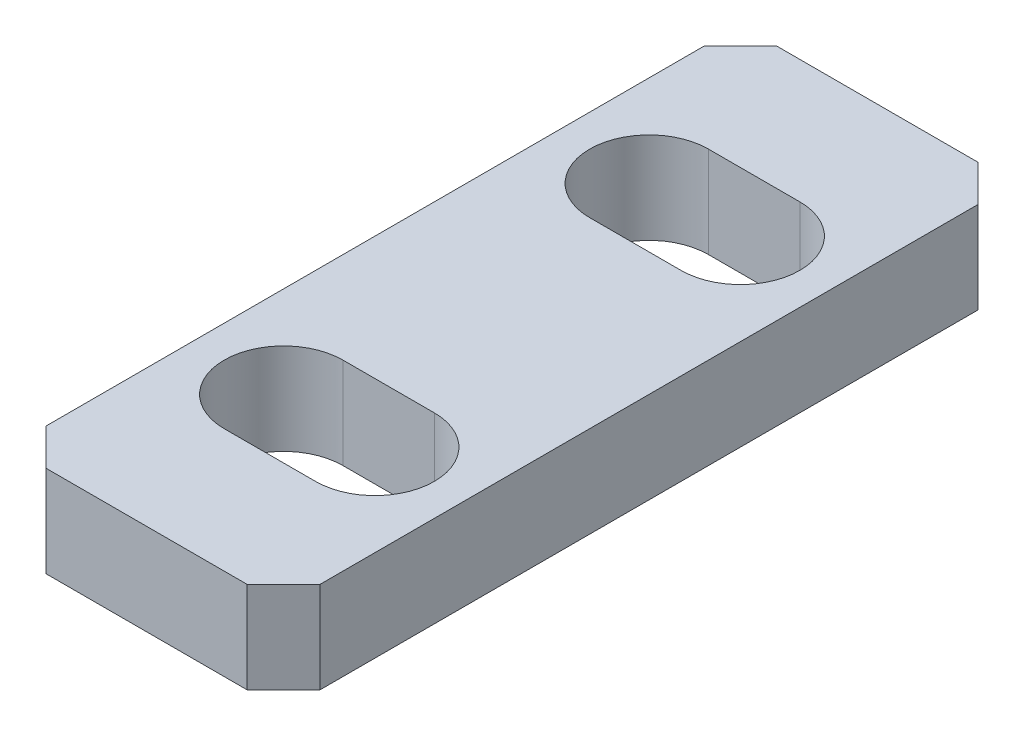
from build123d import *

# Parameters (mm, degrees)
BOSS_EXTRUDE1_DEPTH = 5


with BuildPart() as part:
    # Sketch1 → Boss-Extrude1 (new body)
    with BuildSketch(Plane(origin=(0, 0, 0), x_dir=(1, 0, 0), z_dir=(0, 1, 0))):
        Polygon((0, 38), (2, 40), (13, 40), (15, 38), (15, 2), (13, 0), (2, 0), (0, 2), align=None)
        with BuildLine():
            Line((5, 33.25), (10, 33.25))
            ThreePointArc((10, 33.25), (13.25, 30), (10, 26.75))
            Line((10, 26.75), (5, 26.75))
            ThreePointArc((5, 26.75), (1.75, 30), (5, 33.25))
        make_face(mode=Mode.SUBTRACT)
        with BuildLine():
            Line((5, 13.25), (10, 13.25))
            ThreePointArc((10, 13.25), (13.25, 10), (10, 6.75))
            Line((10, 6.75), (5, 6.75))
            ThreePointArc((5, 6.75), (1.75, 10), (5, 13.25))
        make_face(mode=Mode.SUBTRACT)
    extrude(amount=BOSS_EXTRUDE1_DEPTH)


solid = part.part
